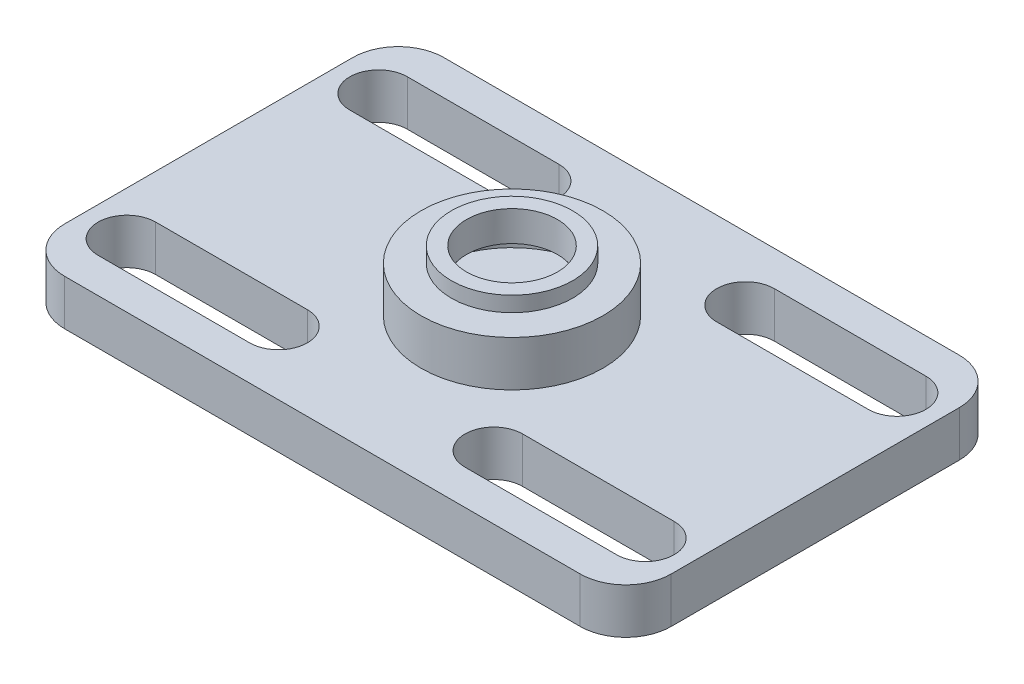
from build123d import *

# Parameters (mm, degrees)
SKETCH1_R           = 20
SKETCH1_R_2         = 15
BOSS_EXTRUDE1_DEPTH = 5
SKETCH2_R           = 30
SKETCH2_R_2         = 15
BOSS_EXTRUDE2_DEPTH = 15
SKETCH3_R           = 27.5
CUT_EXTRUDE1_DEPTH  = 10
SKETCH4_W           = 200
SKETCH4_H           = 125
BOSS_EXTRUDE3_DEPTH = 15
FILLET1_R           = 15


with BuildPart() as part:
    # Sketch1 → Boss-Extrude1 (new body)
    with BuildSketch(Plane(origin=(0, 0, 0), x_dir=(1, 0, 0), z_dir=(0, 1, 0))):
        with Locations(Location((0, 0, 0), (0, 0, 270))):
            Circle(SKETCH1_R)
        with Locations(Location((0, 0, 0), (0, 0, 270))):
            Circle(SKETCH1_R_2, mode=Mode.SUBTRACT)
    extrude(amount=-BOSS_EXTRUDE1_DEPTH)

    # Sketch2 → Boss-Extrude2 (add)
    with BuildSketch(Plane.XZ.offset(5)):
        with Locations(Location((0, 0, 0), (0, 0, 270))):
            Circle(SKETCH2_R)
        with Locations(Location((0, 0, 0), (0, 0, 90))):
            Circle(SKETCH2_R_2, mode=Mode.SUBTRACT)
    extrude(amount=BOSS_EXTRUDE2_DEPTH)

    # Sketch3 → Cut-Extrude1 (cut)
    with BuildSketch(Plane.XZ.offset(20)):
        with Locations(Location((0, 0, 0), (0, 0, 270))):
            Circle(SKETCH3_R)
    extrude(amount=-CUT_EXTRUDE1_DEPTH, mode=Mode.SUBTRACT)

    # Sketch4 → Boss-Extrude3 (add)
    with BuildSketch(Plane.XZ.offset(20)):
        Rectangle(SKETCH4_W, SKETCH4_H)
        with BuildLine():
            Line((-85.5, 51), (-35.5, 51))
            ThreePointArc((-35.5, 51), (-26, 41.5), (-35.5, 32))
            Line((-35.5, 32), (-85.5, 32))
            ThreePointArc((-85.5, 32), (-95, 41.5), (-85.5, 51))
        make_face(mode=Mode.SUBTRACT)
        with BuildLine():
            Line((-85.5, -51), (-35.5, -51))
            ThreePointArc((-35.5, -51), (-26, -41.5), (-35.5, -32))
            Line((-35.5, -32), (-85.5, -32))
            ThreePointArc((-85.5, -32), (-95, -41.5), (-85.5, -51))
        make_face(mode=Mode.SUBTRACT)
        with BuildLine():
            Line((85.5, 51), (35.5, 51))
            ThreePointArc((35.5, 51), (26, 41.5), (35.5, 32))
            Line((35.5, 32), (85.5, 32))
            ThreePointArc((85.5, 32), (95, 41.5), (85.5, 51))
        make_face(mode=Mode.SUBTRACT)
        with BuildLine():
            Line((85.5, -51), (35.5, -51))
            ThreePointArc((35.5, -51), (26, -41.5), (35.5, -32))
            Line((35.5, -32), (85.5, -32))
            ThreePointArc((85.5, -32), (95, -41.5), (85.5, -51))
        make_face(mode=Mode.SUBTRACT)
    extrude(amount=BOSS_EXTRUDE3_DEPTH)

    # Fillet1
    fillet1_edges = [part.edges().sort_by_distance(p)[0] for p in [
        (100, -27.5, 62.5),
        (-100, -27.5, 62.5),
        (-100, -27.5, -62.5),
        (100, -27.5, -62.5),
    ]]
    fillet(fillet1_edges, radius=FILLET1_R)


solid = part.part
